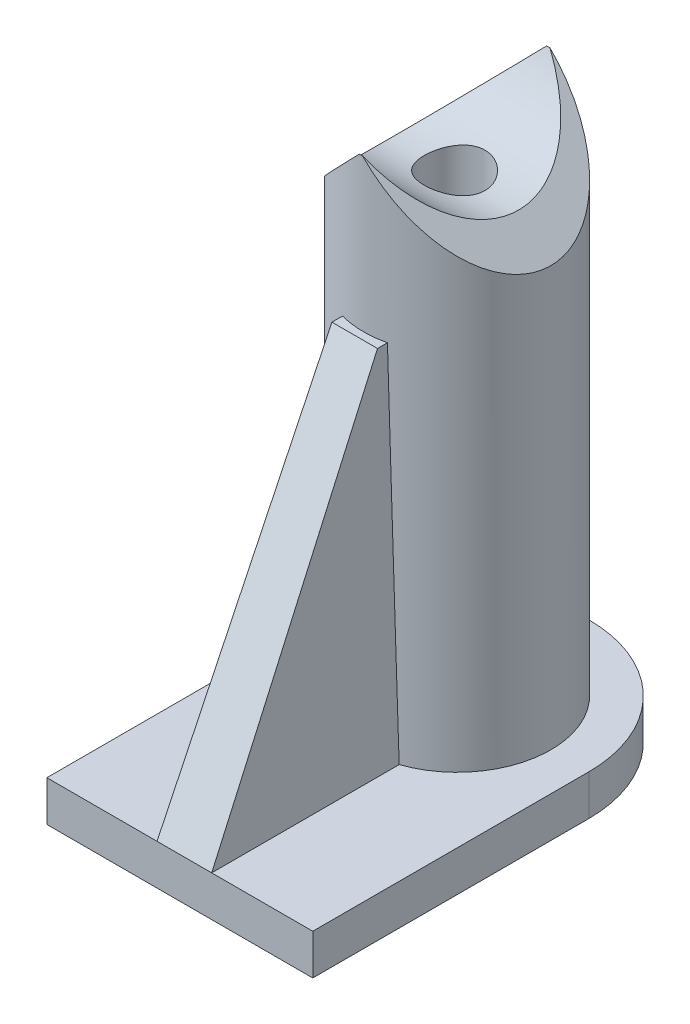
from build123d import *

# Parameters (mm, degrees)
SKETCH1_W                = 10.5
SKETCH1_H                = 16.1
BOSS_EXTRUDE1_DEPTH      = 1.6
FILLET1_R                = 5.2
SKETCH2_R                = 3.7
BOSS_EXTRUDE2_DEPTH      = 20.3
SKETCH3_R                = 4.004738107
CUT_EXTRUDE1_DEPTH       = 20.3
CUT_EXTRUDE2_START       = 14.8
CUT_EXTRUDE2_DEPTH       = 14.156215839
CUT_EXTRUDE4_DEPTH       = 20.3
SKETCH6_R                = 2.275
CUT_EXTRUDE5_DEPTH       = 16.3
CHAMFER1_SIZE            = 1
CUT_EXTRUDE6_REACH       = 27.202
CUT_EXTRUDE6_END_RADIUS  = 4.004738107
SKETCH7_R                = 1.2
BOSS_EXTRUDE4_REACH      = 31.138
BOSS_EXTRUDE4_END_RADIUS = 3.7
CUT_EXTRUDE8_REACH       = 29.868


with BuildPart() as part:
    # Sketch1 → Boss-Extrude1 (new body)
    with BuildSketch(Plane(origin=(0, 0, 0), x_dir=(1, 0, 0), z_dir=(0, 1, 0))):
        with Locations((5.25, -8.05)):
            Rectangle(SKETCH1_W, SKETCH1_H)
    extrude(amount=BOSS_EXTRUDE1_DEPTH)

    # Fillet1
    fillet1_edges = [part.edges().sort_by_distance(p)[0] for p in [
        (0, 0.8, 0),
        (10.5, 0.8, 0),
    ]]
    fillet(fillet1_edges, radius=FILLET1_R)

    # Sketch2 → Boss-Extrude2 (add)
    with BuildSketch(Plane(origin=(0, 1.6, 0), x_dir=(1, 0, 0), z_dir=(0, 1, 0))):
        with Locations(Location((5.2, -5.2, 0), (0, 0, 270))):
            Circle(SKETCH2_R)
    extrude(amount=BOSS_EXTRUDE2_DEPTH)

    # Sketch3 → Cut-Extrude1 (cut)
    with BuildSketch(Plane(origin=(10.5, 0, 0), x_dir=(0, 0, -1), z_dir=(1, 0, 0))):
        with Locations((-5.2, 23.432294784)):
            Circle(SKETCH3_R)
    extrude(amount=-CUT_EXTRUDE1_DEPTH, mode=Mode.SUBTRACT)

    # Sketch4 → Cut-Extrude2 (cut, through all)
    with BuildSketch(Plane(origin=(0, 1.6, 0), x_dir=(1, 0, 0), z_dir=(0, 1, 0)).offset(CUT_EXTRUDE2_START)):
        with BuildLine():
            Line((7.790601515, -2.558261218), (7.790601515, -7.841738782))
            ThreePointArc((7.790601515, -7.841738782), (8.9, -5.2), (7.790601515, -2.558261218))
        make_face()
    extrude(amount=CUT_EXTRUDE2_DEPTH, mode=Mode.SUBTRACT)

    # Sketch5 → Cut-Extrude4 (cut)
    with BuildSketch(Plane.XY.offset(16.1)):
        Polygon((5.3, 21.958982239), (7.790601515, 19.4), (9.828300682, 21.383248088), (4.534562835, 26.822328186), (-0.186346152, 21.958982239), (1.5, 18.158982239), align=None)
    extrude(amount=-CUT_EXTRUDE4_DEPTH, mode=Mode.SUBTRACT)

    # Sketch6 → Cut-Extrude5 (cut)
    with BuildSketch(Plane(origin=(0, 0, 0), x_dir=(-1, 0, 0), z_dir=(0, -1, 0))):
        with Locations(Location((-5.3, -5.2, 0), (0, 0, 90))):
            Circle(SKETCH6_R)
    extrude(amount=-CUT_EXTRUDE5_DEPTH, mode=Mode.SUBTRACT)

    # Chamfer1
    chamfer1_edges = [part.edges().sort_by_distance(p)[0] for p in [
        (5.3, 0, 7.475),
    ]]
    chamfer(chamfer1_edges, length=CHAMFER1_SIZE)

    # Cut-Extrude6: up to this cylinder (the profile starts outside it)
    cut_extrude6_end = Plane(origin=(5.3, 23.432294784, 5.2), z_dir=(1, 0, 0)) * Cylinder(CUT_EXTRUDE6_END_RADIUS, 63.413476214, mode=Mode.PRIVATE)
    # Sketch7 → Cut-Extrude6 (cut, up to the surface)
    with BuildSketch(Plane.XZ.offset(-16.3), mode=Mode.PRIVATE) as cut_extrude6_sk1:
        with Locations(Location((5.3, 5.2, 0), (0, 0, 270))):
            Circle(SKETCH7_R)
    cut_extrude6_tool1 = extrude(cut_extrude6_sk1.sketch, amount=-CUT_EXTRUDE6_REACH, mode=Mode.PRIVATE) - cut_extrude6_end
    add(cut_extrude6_tool1.solids().sort_by_distance((5.3, 16.3, 5.2))[0], mode=Mode.SUBTRACT)

    # Boss-Extrude4: up to this cylinder (the profile starts outside it)
    boss_extrude4_end = Plane(origin=(5.2, 8.53398, 5.2), z_dir=(0, -1, 0)) * Cylinder(BOSS_EXTRUDE4_END_RADIUS, 70.676, mode=Mode.PRIVATE)
    # Sketch8 → Boss-Extrude4 (add, up to the surface)
    with BuildSketch(Plane.XY.offset(16.1), mode=Mode.PRIVATE) as boss_extrude4_sk1:
        Polygon((4.35, 15.9), (3.991182401, 1.6), (6.15, 1.6), (6.15, 15.9), align=None)
    boss_extrude4_tool1 = extrude(boss_extrude4_sk1.sketch, amount=-BOSS_EXTRUDE4_REACH, mode=Mode.PRIVATE) - boss_extrude4_end
    add(boss_extrude4_tool1.solids().sort_by_distance((5.157585, 8.53398, 16.1))[0])

    # Cut-Extrude8: up to this plane
    cut_extrude8_end = Plane(origin=(4.35, 15.9, -500000), z_dir=(-0.9996853408377463, 0.025084244340203392, 0))
    # Sketch11 → Cut-Extrude8 (cut, up to the surface)
    with BuildSketch(Plane(origin=(6.15, 0, 0), x_dir=(0, 0, -1), z_dir=(1, 0, 0)), mode=Mode.PRIVATE) as cut_extrude8_sk1:
        Polygon((-16.1, 15.9), (-16.1, 1.6), (-9.19348511, 15.9), align=None)
    cut_extrude8_tool1 = split(extrude(cut_extrude8_sk1.sketch, amount=-CUT_EXTRUDE8_REACH, mode=Mode.PRIVATE), bisect_by=cut_extrude8_end, keep=Keep.BOTH, mode=Mode.PRIVATE)
    add(cut_extrude8_tool1.solids().sort_by_distance((6.15, 11.133333, 13.797828))[0], mode=Mode.SUBTRACT)


with BuildPart() as body_2:
    # Mirror3: mirrored copy
    add(part.part.mirror(Plane(origin=(0, 1.6, 0), x_dir=(0, 0, 1), z_dir=(1, 0, 0))))


solid = body_2.part
